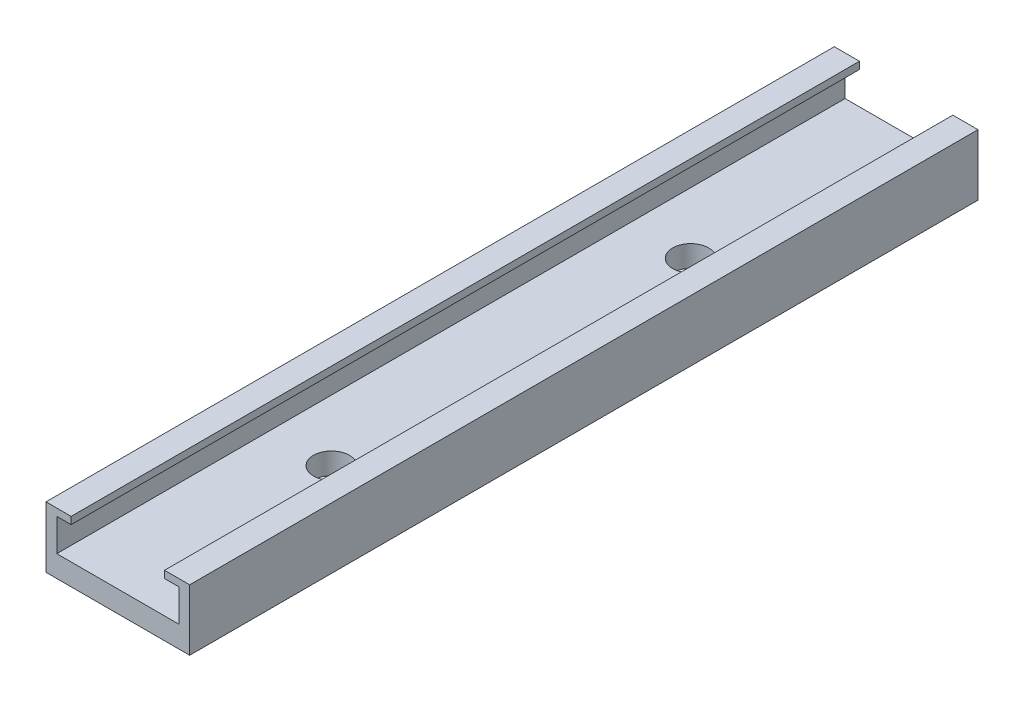
from build123d import *

# Parameters (mm, degrees)
BOSS_EXTRUDE2_DEPTH = 109.73
SKETCH2_R           = 2.5
CUT_EXTRUDE1_DEPTH  = 10


with BuildPart() as part:
    # Sketch1 → Boss-Extrude2 (new body)
    with BuildSketch(Plane.XY):
        Polygon((-10, 0.391567614), (-10, -3.576580006), (-10, -8.108432386), (10, -8.108432386), (10, 0.391567614), (6.5, 0.391567614), (6.5, -0.608432386), (8.5, -0.608432386), (8.5, -5.108432386), (-8.5, -5.108432386), (-8.5, -0.608432386), (-6.5, -0.608432386), (-6.5, 0.391567614), align=None)
    extrude(amount=BOSS_EXTRUDE2_DEPTH)

    # Sketch2 → Cut-Extrude1 (cut)
    with BuildSketch(Plane.XZ.offset(8.108432386)):
        with Locations((0, 30)):
            Circle(SKETCH2_R)
        with Locations((0, 80)):
            Circle(SKETCH2_R)
    extrude(amount=-CUT_EXTRUDE1_DEPTH, mode=Mode.SUBTRACT)


solid = part.part
